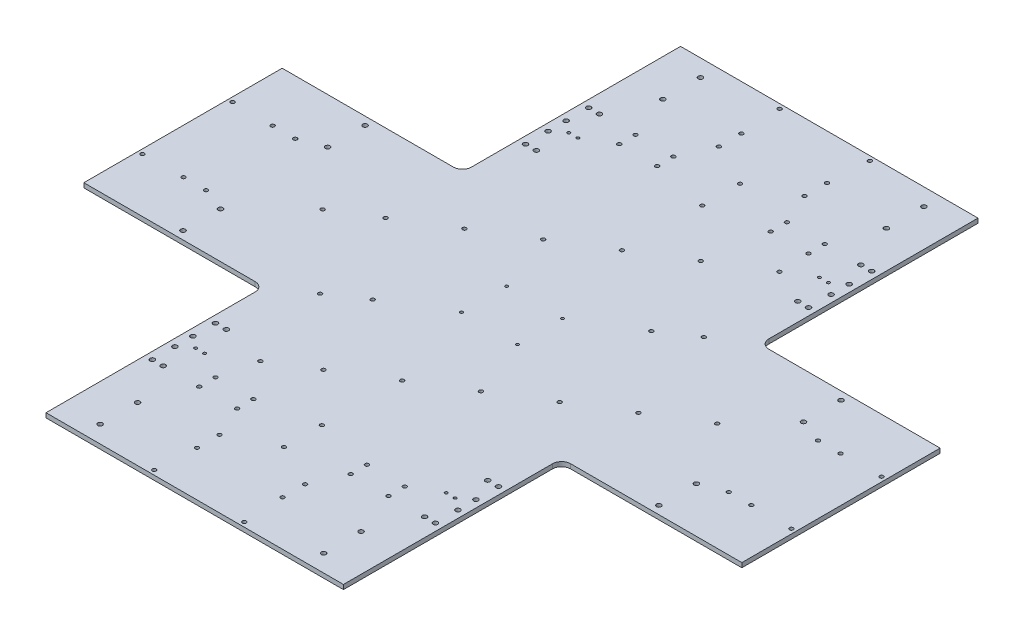
from build123d import *

# Parameters (mm, degrees)
BOSS_EXTRUDE1_DEPTH = 5
SKETCH2_R           = 2.125
CUT_EXTRUDE1_DEPTH  = 3
SKETCH4_R           = 2.6
SKETCH4_R_2         = 1.6
CUT_EXTRUDE3_DEPTH  = 10
SKETCH5_R           = 2.125
CUT_EXTRUDE4_DEPTH  = 10
FILLET1_R           = 10
SKETCH6_R           = 2.6
CUT_EXTRUDE5_DEPTH  = 10
SKETCH7_R           = 2.125
CUT_EXTRUDE6_DEPTH  = 10
SKETCH8_R           = 2.1
CUT_EXTRUDE7_DEPTH  = 10
SKETCH9_R           = 1.575
CUT_EXTRUDE8_DEPTH  = 10
SKETCH11_R          = 2.125
CUT_EXTRUDE9_DEPTH  = 10


with BuildPart() as part:
    # Sketch1 → Boss-Extrude1 (new body)
    with BuildSketch(Plane(origin=(0, 0, 0), x_dir=(1, 0, 0), z_dir=(0, 1, 0))):
        Polygon((165, 352), (-165, 352), (-165, 110), (-365, 110), (-365, -110), (-165, -110), (-165, -352), (165, -352), (165, -110), (365, -110), (365, 110), (165, 110), align=None)
    extrude(amount=BOSS_EXTRUDE1_DEPTH)

    # Sketch2 → Cut-Extrude1 (cut)
    with BuildSketch(Plane(origin=(0, 5, 0), x_dir=(1, 0, 0), z_dir=(0, 1, 0))):
        with Locations(Location((315, 49.5, 0), (0, 0, 270))):
            Circle(SKETCH2_R)
        with Locations(Location((290, 49.5, 0), (0, 0, 270))):
            Circle(SKETCH2_R)
        with Locations(Location((290, -49.5, 0), (0, 0, 90))):
            Circle(SKETCH2_R)
        with Locations(Location((315, -49.5, 0), (0, 0, 90))):
            Circle(SKETCH2_R)
        with Locations(Location((-315, -49.5, 0), (0, 0, 270))):
            Circle(SKETCH2_R)
        with Locations(Location((-290, -49.5, 0), (0, 0, 270))):
            Circle(SKETCH2_R)
        with Locations(Location((-290, 49.5, 0), (0, 0, 90))):
            Circle(SKETCH2_R)
        with Locations(Location((-315, 49.5, 0), (0, 0, 90))):
            Circle(SKETCH2_R)
        with Locations(Location((47.5, 302, 0), (0, 0, 270))):
            Circle(SKETCH2_R)
        with Locations(Location((47.5, 277, 0), (0, 0, 270))):
            Circle(SKETCH2_R)
        with Locations(Location((-47.5, 277, 0), (0, 0, 90))):
            Circle(SKETCH2_R)
        with Locations(Location((-47.5, 302, 0), (0, 0, 90))):
            Circle(SKETCH2_R)
        with Locations(Location((-47.5, -302, 0), (0, 0, 270))):
            Circle(SKETCH2_R)
        with Locations(Location((-47.5, -277, 0), (0, 0, 270))):
            Circle(SKETCH2_R)
        with Locations(Location((47.5, -277, 0), (0, 0, 90))):
            Circle(SKETCH2_R)
        with Locations(Location((47.5, -302, 0), (0, 0, 90))):
            Circle(SKETCH2_R)
    extrude(amount=-CUT_EXTRUDE1_DEPTH, mode=Mode.SUBTRACT)

    # Sketch4 → Cut-Extrude3 (cut)
    with BuildSketch(Plane(origin=(0, 5, 0), x_dir=(1, 0, 0), z_dir=(0, 1, 0))):
        with Locations(Location((-157, 172, 0), (0, 0, 270))):
            Circle(SKETCH4_R)
        with Locations(Location((-145, 172, 0), (0, 0, 270))):
            Circle(SKETCH4_R)
        with Locations(Location((-157, 197, 0), (0, 0, 270))):
            Circle(SKETCH4_R)
        with Locations(Location((-157, 217, 0), (0, 0, 270))):
            Circle(SKETCH4_R)
        with Locations(Location((-157, 242, 0), (0, 0, 270))):
            Circle(SKETCH4_R)
        with Locations(Location((-145, 242, 0), (0, 0, 270))):
            Circle(SKETCH4_R)
        with Locations(Location((145, 242, 0), (0, 0, 90))):
            Circle(SKETCH4_R)
        with Locations(Location((157, 242, 0), (0, 0, 90))):
            Circle(SKETCH4_R)
        with Locations(Location((157, 217, 0), (0, 0, 90))):
            Circle(SKETCH4_R)
        with Locations(Location((157, 197, 0), (0, 0, 90))):
            Circle(SKETCH4_R)
        with Locations(Location((145, 172, 0), (0, 0, 90))):
            Circle(SKETCH4_R)
        with Locations(Location((157, 172, 0), (0, 0, 90))):
            Circle(SKETCH4_R)
        with Locations(Location((157, -172, 0), (0, 0, 270))):
            Circle(SKETCH4_R)
        with Locations(Location((145, -172, 0), (0, 0, 270))):
            Circle(SKETCH4_R)
        with Locations(Location((157, -197, 0), (0, 0, 270))):
            Circle(SKETCH4_R)
        with Locations(Location((157, -217, 0), (0, 0, 270))):
            Circle(SKETCH4_R)
        with Locations(Location((157, -242, 0), (0, 0, 270))):
            Circle(SKETCH4_R)
        with Locations(Location((145, -242, 0), (0, 0, 270))):
            Circle(SKETCH4_R)
        with Locations(Location((-145, -242, 0), (0, 0, 90))):
            Circle(SKETCH4_R)
        with Locations(Location((-157, -242, 0), (0, 0, 90))):
            Circle(SKETCH4_R)
        with Locations(Location((-157, -217, 0), (0, 0, 90))):
            Circle(SKETCH4_R)
        with Locations(Location((-157, -197, 0), (0, 0, 90))):
            Circle(SKETCH4_R)
        with Locations(Location((-145, -172, 0), (0, 0, 90))):
            Circle(SKETCH4_R)
        with Locations(Location((-157, -172, 0), (0, 0, 90))):
            Circle(SKETCH4_R)
        with Locations(Location((144, -207, 0), (0, 0, 270))):
            Circle(SKETCH4_R_2)
        with Locations(Location((-144, -207, 0), (0, 0, 90))):
            Circle(SKETCH4_R_2)
        with Locations(Location((144, 207, 0), (0, 0, 90))):
            Circle(SKETCH4_R_2)
        with Locations(Location((-144, 207, 0), (0, 0, 270))):
            Circle(SKETCH4_R_2)
        with Locations(Location((134, -207, 0), (0, 0, 270))):
            Circle(SKETCH4_R_2)
        with Locations(Location((-134, -207, 0), (0, 0, 90))):
            Circle(SKETCH4_R_2)
        with Locations(Location((134, 207, 0), (0, 0, 90))):
            Circle(SKETCH4_R_2)
        with Locations(Location((-134, 207, 0), (0, 0, 270))):
            Circle(SKETCH4_R_2)
    extrude(amount=-CUT_EXTRUDE3_DEPTH, mode=Mode.SUBTRACT)

    # Sketch5 → Cut-Extrude4 (cut)
    with BuildSketch(Plane(origin=(0, 5, 0), x_dir=(1, 0, 0), z_dir=(0, 1, 0))):
        with Locations(Location((-50, 347, 0), (0, 0, 270))):
            Circle(SKETCH5_R)
        with Locations(Location((50, 347, 0), (0, 0, 270))):
            Circle(SKETCH5_R)
        with Locations(Location((50, -347, 0), (0, 0, 90))):
            Circle(SKETCH5_R)
        with Locations(Location((-50, -347, 0), (0, 0, 90))):
            Circle(SKETCH5_R)
        with Locations(Location((-360, 50, 0), (0, 0, 270))):
            Circle(SKETCH5_R)
        with Locations(Location((-360, -50, 0), (0, 0, 270))):
            Circle(SKETCH5_R)
        with Locations(Location((360, -50, 0), (0, 0, 90))):
            Circle(SKETCH5_R)
        with Locations(Location((360, 50, 0), (0, 0, 90))):
            Circle(SKETCH5_R)
    extrude(amount=-CUT_EXTRUDE4_DEPTH, mode=Mode.SUBTRACT)

    # Fillet1
    fillet1_edges = [part.edges().sort_by_distance(p)[0] for p in [
        (165, 2.5, -110),
        (165, 2.5, 110),
        (-165, 2.5, 110),
        (-165, 2.5, -110),
    ]]
    fillet(fillet1_edges, radius=FILLET1_R)

    # Sketch6 → Cut-Extrude5 (cut)
    with BuildSketch(Plane(origin=(0, 5, 0), x_dir=(1, 0, 0), z_dir=(0, 1, 0))):
        with Locations(Location((124, 333, 0), (0, 0, 270))):
            Circle(SKETCH6_R)
        with Locations(Location((124, 291.4, 0), (0, 0, 270))):
            Circle(SKETCH6_R)
        with Locations(Location((124, -291.4, 0), (0, 0, 90))):
            Circle(SKETCH6_R)
        with Locations(Location((124, -333, 0), (0, 0, 90))):
            Circle(SKETCH6_R)
        with Locations(Location((-124, -333, 0), (0, 0, 270))):
            Circle(SKETCH6_R)
        with Locations(Location((-124, -291.4, 0), (0, 0, 270))):
            Circle(SKETCH6_R)
        with Locations(Location((-124, 291.4, 0), (0, 0, 90))):
            Circle(SKETCH6_R)
        with Locations(Location((-124, 333, 0), (0, 0, 90))):
            Circle(SKETCH6_R)
        with Locations(Location((264, 101, 0), (0, 0, 270))):
            Circle(SKETCH6_R)
        with Locations(Location((264, 59.4, 0), (0, 0, 270))):
            Circle(SKETCH6_R)
        with Locations(Location((264, -59.4, 0), (0, 0, 90))):
            Circle(SKETCH6_R)
        with Locations(Location((264, -101, 0), (0, 0, 90))):
            Circle(SKETCH6_R)
        with Locations(Location((-264, -101, 0), (0, 0, 270))):
            Circle(SKETCH6_R)
        with Locations(Location((-264, -59.4, 0), (0, 0, 270))):
            Circle(SKETCH6_R)
        with Locations(Location((-264, 59.4, 0), (0, 0, 90))):
            Circle(SKETCH6_R)
        with Locations(Location((-264, 101, 0), (0, 0, 90))):
            Circle(SKETCH6_R)
    extrude(amount=-CUT_EXTRUDE5_DEPTH, mode=Mode.SUBTRACT)

    # Sketch7 → Cut-Extrude6 (cut)
    with BuildSketch(Plane(origin=(0, 5, 0), x_dir=(1, 0, 0), z_dir=(0, 1, 0))):
        with Locations(Location((-55.682048102, 90.197059371, 0), (0, 0, 270))):
            Circle(SKETCH7_R)
        with Locations(Location((-1.648904044, 123.553757998, 0), (0, 0, 270))):
            Circle(SKETCH7_R)
        with Locations(Location((52.384240013, 156.910456625, 0), (0, 0, 270))):
            Circle(SKETCH7_R)
        with Locations(Location((106.41738407, 190.267155252, 0), (0, 0, 270))):
            Circle(SKETCH7_R)
        with Locations(Location((-109.715192159, 56.840360744, 0), (0, 0, 270))):
            Circle(SKETCH7_R)
        with Locations(Location((-163.748336216, 23.483662117, 0), (0, 0, 270))):
            Circle(SKETCH7_R)
        with Locations(Location((-206.974851462, -3.201696784, 0), (0, 0, 270))):
            Circle(SKETCH7_R)
        with Locations(Location((-95.610755259, -183.595815527, 0), (0, 0, 90))):
            Circle(SKETCH7_R)
        with Locations(Location((-52.384240013, -156.910456625, 0), (0, 0, 90))):
            Circle(SKETCH7_R)
        with Locations(Location((1.648904044, -123.553757998, 0), (0, 0, 90))):
            Circle(SKETCH7_R)
        with Locations(Location((217.781480273, 9.87303651, 0), (0, 0, 90))):
            Circle(SKETCH7_R)
        with Locations(Location((163.748336216, -23.483662117, 0), (0, 0, 90))):
            Circle(SKETCH7_R)
        with Locations(Location((109.715192159, -56.840360744, 0), (0, 0, 90))):
            Circle(SKETCH7_R)
        with Locations(Location((55.682048102, -90.197059371, 0), (0, 0, 90))):
            Circle(SKETCH7_R)
    extrude(amount=-CUT_EXTRUDE6_DEPTH, mode=Mode.SUBTRACT)

    # Sketch8 → Cut-Extrude7 (cut)
    with BuildSketch(Plane(origin=(0, 5, 0), x_dir=(1, 0, 0), z_dir=(0, 1, 0))):
        with Locations(Location((-127.267902287, -85.585182493, 0), (0, 0, 270))):
            Circle(SKETCH8_R)
        with Locations(Location((-92.415590944, -62.147682754, 0), (0, 0, 270))):
            Circle(SKETCH8_R)
        with Locations(Location((92.415590944, 62.147682754, 0), (0, 0, 270))):
            Circle(SKETCH8_R)
        with Locations(Location((127.267902287, 85.585182493, 0), (0, 0, 270))):
            Circle(SKETCH8_R)
        with Locations(Location((0, 253, 0), (0, 0, 270))):
            Circle(SKETCH8_R)
        with Locations(Location((0, 211, 0), (0, 0, 270))):
            Circle(SKETCH8_R)
        with Locations(Location((0, -211, 0), (0, 0, 90))):
            Circle(SKETCH8_R)
        with Locations(Location((0, -253, 0), (0, 0, 90))):
            Circle(SKETCH8_R)
    extrude(amount=-CUT_EXTRUDE7_DEPTH, mode=Mode.SUBTRACT)

    # Sketch9 → Cut-Extrude8 (cut)
    with BuildSketch(Plane(origin=(0, 5, 0), x_dir=(1, 0, 0), z_dir=(0, 1, 0))):
        with Locations(Location((-31, 25, 0), (0, 0, 270))):
            Circle(SKETCH9_R)
        with Locations(Location((-31, -25, 0), (0, 0, 90))):
            Circle(SKETCH9_R)
        with Locations(Location((31, -25, 0), (0, 0, 270))):
            Circle(SKETCH9_R)
        with Locations(Location((31, 25, 0), (0, 0, 90))):
            Circle(SKETCH9_R)
    extrude(amount=-CUT_EXTRUDE8_DEPTH, mode=Mode.SUBTRACT)

    # Sketch11 → Cut-Extrude9 (cut)
    with BuildSketch(Plane(origin=(0, 5, 0), x_dir=(1, 0, 0), z_dir=(0, 1, 0))):
        with Locations(Location((63, 242, 0), (0, 0, 270))):
            Circle(SKETCH11_R)
        with Locations(Location((63, 224, 0), (0, 0, 270))):
            Circle(SKETCH11_R)
        with Locations(Location((105, 242, 0), (0, 0, 270))):
            Circle(SKETCH11_R)
        with Locations(Location((105, 224, 0), (0, 0, 270))):
            Circle(SKETCH11_R)
        with Locations(Location((-105, 224, 0), (0, 0, 90))):
            Circle(SKETCH11_R)
        with Locations(Location((-105, 242, 0), (0, 0, 90))):
            Circle(SKETCH11_R)
        with Locations(Location((-63, 224, 0), (0, 0, 90))):
            Circle(SKETCH11_R)
        with Locations(Location((-63, 242, 0), (0, 0, 90))):
            Circle(SKETCH11_R)
        with Locations(Location((-63, -242, 0), (0, 0, 270))):
            Circle(SKETCH11_R)
        with Locations(Location((-63, -224, 0), (0, 0, 270))):
            Circle(SKETCH11_R)
        with Locations(Location((-105, -242, 0), (0, 0, 270))):
            Circle(SKETCH11_R)
        with Locations(Location((-105, -224, 0), (0, 0, 270))):
            Circle(SKETCH11_R)
        with Locations(Location((105, -224, 0), (0, 0, 90))):
            Circle(SKETCH11_R)
        with Locations(Location((105, -242, 0), (0, 0, 90))):
            Circle(SKETCH11_R)
        with Locations(Location((63, -224, 0), (0, 0, 90))):
            Circle(SKETCH11_R)
        with Locations(Location((63, -242, 0), (0, 0, 90))):
            Circle(SKETCH11_R)
    extrude(amount=-CUT_EXTRUDE9_DEPTH, mode=Mode.SUBTRACT)


solid = part.part
